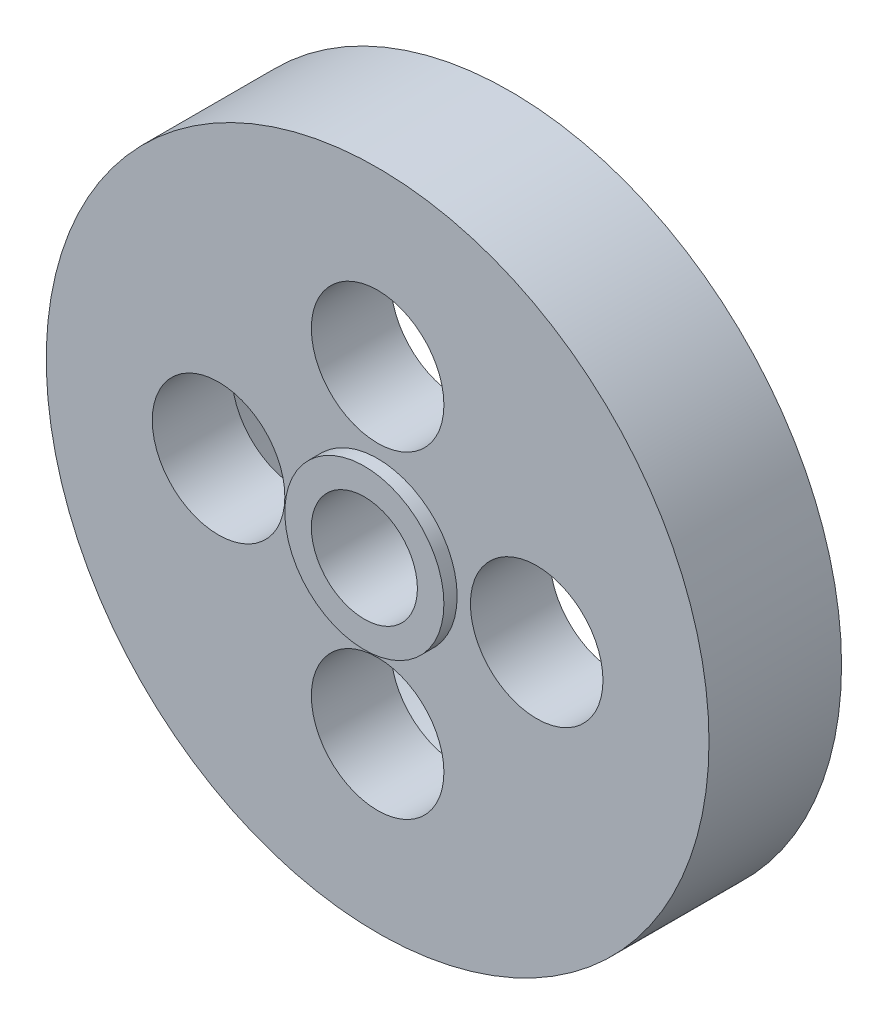
from build123d import *

# Parameters (mm, degrees)
SKETCH2_R           = 25
SKETCH2_R_2         = 5
SKETCH2_R_3         = 4
BOSS_EXTRUDE1_DEPTH = 5
SKETCH3_R           = 18
CUT_EXTRUDE1_DEPTH  = 4
SKETCH5_R           = 6
SKETCH5_R_2         = 4
BOSS_EXTRUDE2_DEPTH = 1


with BuildPart() as part:
    # Sketch2 → Boss-Extrude1 (new, symmetric)
    with BuildSketch(Plane.XY):
        Circle(SKETCH2_R)
        with Locations((0, 12)):
            Circle(SKETCH2_R_2, mode=Mode.SUBTRACT)
        Circle(SKETCH2_R_3, mode=Mode.SUBTRACT)
        with Locations((12, 0)):
            Circle(SKETCH2_R_2, mode=Mode.SUBTRACT)
        with Locations((0, -12)):
            Circle(SKETCH2_R_2, mode=Mode.SUBTRACT)
        with Locations((-12, 0)):
            Circle(SKETCH2_R_2, mode=Mode.SUBTRACT)
    extrude(amount=BOSS_EXTRUDE1_DEPTH, both=True)

    # Sketch3 → Cut-Extrude1 (cut)
    with BuildSketch(Plane(origin=(0, 0, -5), x_dir=(-1, 0, 0), z_dir=(0, 0, -1))):
        Circle(SKETCH3_R)
    extrude(amount=-CUT_EXTRUDE1_DEPTH, mode=Mode.SUBTRACT)

    # Sketch5 → Boss-Extrude2 (add)
    with BuildSketch(Plane.XY.offset(5)):
        Circle(SKETCH5_R)
        with Locations(Location((0, 0, 0), (0, 0, 180))):
            Circle(SKETCH5_R_2, mode=Mode.SUBTRACT)
    extrude(amount=BOSS_EXTRUDE2_DEPTH)


solid = part.part
